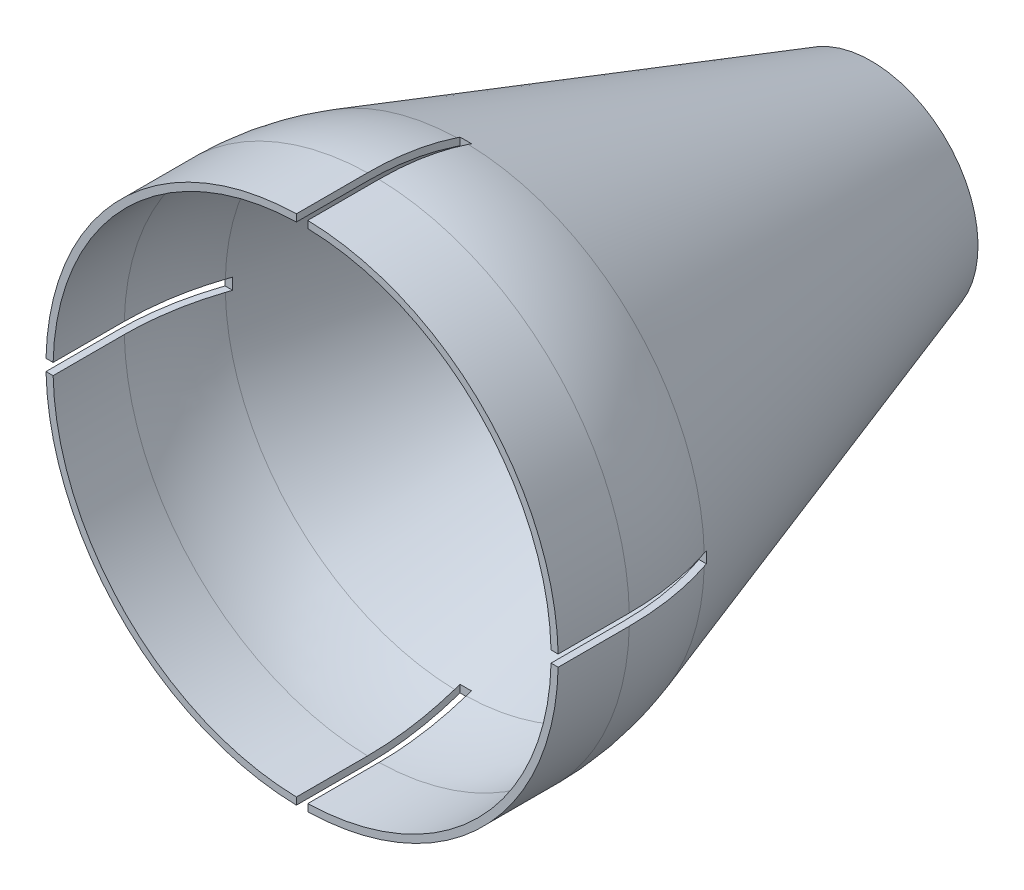
from build123d import *

# Parameters (mm, degrees)
SKETCH2_W          = 0.8
SKETCH2_H          = 11.5
CUT_EXTRUDE1_DEPTH = 48.41307844
CIRPATTERN1_COUNT  = 4


with BuildPart() as part:
    # Sketch1 → Revolve-Thin1 (revolve)
    with BuildSketch(Plane(origin=(0, 0, 0), x_dir=(0, 0, -1), z_dir=(1, 0, 0))):
        with BuildLine():
            Line((0, 7.5), (-28.725975148, 16.990434754))
            ThreePointArc((-28.725975148, 16.990434754), (-31.822634352, 17.745995734), (-35, 18))
            Line((-35, 18), (-40, 18))
            Line((-40, 18), (-40, 17.5))
            Line((-40, 17.5), (-35, 17.5))
            ThreePointArc((-35, 17.5), (-31.902068494, 17.252345841), (-28.882825769, 16.515673885))
            Line((-28.882825769, 16.515673885), (-0.156850621, 7.025239131))
            Line((-0.156850621, 7.025239131), (0, 7.5))
        make_face()
    revolve(axis=Axis((0, 0, 0), (0, 0, 1)))

    # Sketch2 → Cut-Extrude1 (cut, through all)
    with BuildSketch(Plane(origin=(0, 0, 0), x_dir=(1, 0, 0), z_dir=(0, 1, 0))):
        with Locations((0, -34.25)):
            Rectangle(SKETCH2_W, SKETCH2_H)
    cut_extrude1 = extrude(amount=-CUT_EXTRUDE1_DEPTH, mode=Mode.SUBTRACT)

    # CirPattern1: Cut-Extrude1 ×4 about axis
    cirpattern1_axis = Axis((0, 0, 44.270736316), (0, 0, -1))
    for i in range(1, CIRPATTERN1_COUNT):
        add(cut_extrude1.rotate(cirpattern1_axis, i * 360 / CIRPATTERN1_COUNT), mode=Mode.SUBTRACT)


solid = part.part
